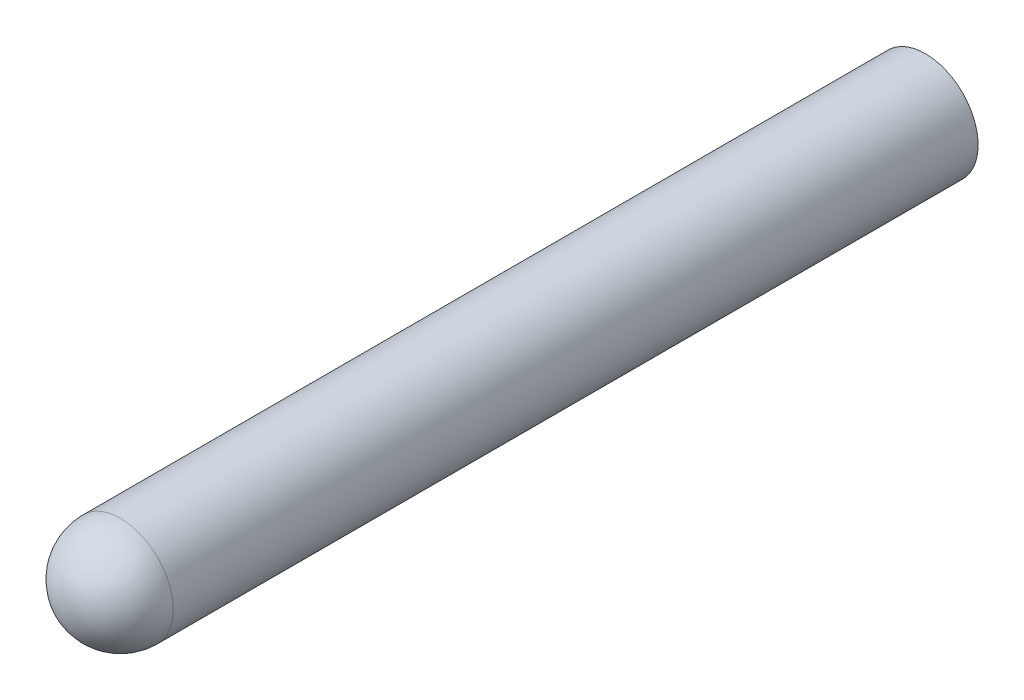
from build123d import *


with BuildPart() as part:
    # Croquis1 → Revolución1 (revolve)
    with BuildSketch(Plane(origin=(0, 0, 0), x_dir=(1, 0, 0), z_dir=(0, 1, 0)), mode=Mode.PRIVATE) as revoluci_n1_sk:
        with BuildLine():
            Line((0, -25.15), (0, -24.3))
            ThreePointArc((0, -24.3), (3.74766594, -22.74766594), (5.3, -19))
            Line((5.3, -19), (5.3, 74.85))
            Line((5.3, 74.85), (6.15, 74.85))
            Line((6.15, 74.85), (6.15, -19))
            ThreePointArc((6.15, -19), (4.348706704, -23.348706704), (0, -25.15))
        make_face()
    revolve(revoluci_n1_sk.sketch.rotate(Axis((0, 0, 25.449822901), (0, 0, -1)), 180), axis=Axis((0, 0, 25.449822901), (0, 0, -1)))


solid = part.part
